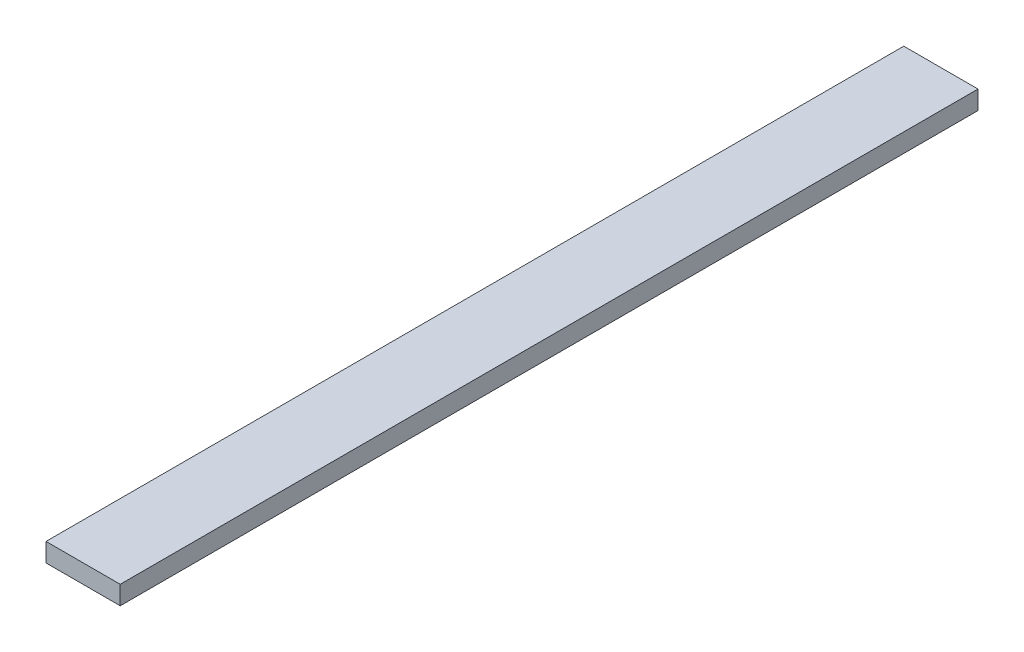
from build123d import *

# Parameters (mm, degrees)
SKETCH1_W           = 25.288073226
SKETCH1_H           = 292.269792562
BOSS_EXTRUDE1_DEPTH = 6.359632809


with BuildPart() as part:
    # Sketch1 → Boss-Extrude1 (new body)
    with BuildSketch(Plane(origin=(0, 0, 0), x_dir=(1, 0, 0), z_dir=(0, 1, 0))):
        with Locations((247.534524911, 113.916507495)):
            Rectangle(SKETCH1_W, SKETCH1_H)
    extrude(amount=BOSS_EXTRUDE1_DEPTH)


solid = part.part
